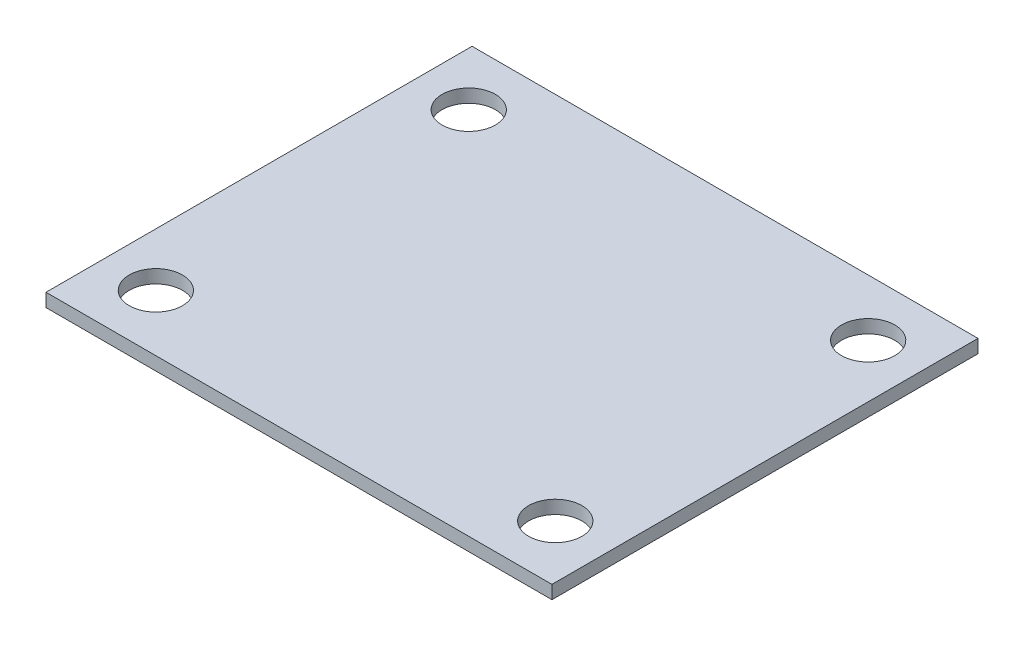
from build123d import *

# Parameters (mm, degrees)
SKETCH1_W               = 38
SKETCH1_H               = 32
BOSS_EXTRUDE1_DEPTH     = 1
SKETCH2_R               = 2
CUT_EXTRUDE1_DEPTH      = 1
MIRROR2_COPY_1_SKETCH_R = 2
MIRROR2_COPY_1_DEPTH    = 1
SKETCH3_R               = 15
SKETCH4_R               = 12
SKETCH5_R               = 9
BOSS_EXTRUDE2_DEPTH     = 1


with BuildPart() as part:
    # Sketch1 → Boss-Extrude1 (new body)
    with BuildSketch(Plane(origin=(0, 0, 0), x_dir=(1, 0, 0), z_dir=(0, 1, 0))):
        Rectangle(SKETCH1_W, SKETCH1_H)
    extrude(amount=BOSS_EXTRUDE1_DEPTH)

    # Sketch2 → Cut-Extrude1 (cut)
    with BuildSketch(Plane(origin=(0, 1, 0), x_dir=(1, 0, 0), z_dir=(0, 1, 0))):
        with Locations(Location((15, -11.75, 0), (0, 0, 270))):
            Circle(SKETCH2_R)
    cut_extrude1 = extrude(amount=-CUT_EXTRUDE1_DEPTH, mode=Mode.SUBTRACT)

    # Mirror1: Cut-Extrude1 across plane
    add(cut_extrude1.mirror(Plane(origin=(0, 0, 0), x_dir=(0, 0, 1), z_dir=(1, 0, 0))), mode=Mode.SUBTRACT)

    # Mirror2: Cut-Extrude1 across plane
    add(cut_extrude1.mirror(Plane.XY), mode=Mode.SUBTRACT)

    # Mirror2 copy 1 sketch → Mirror2 copy 1 (cut)
    with BuildSketch(Plane(origin=(0, 1, 0), x_dir=(-1, 0, 0), z_dir=(0, 1, 0))):
        with Locations(Location((15, -11.75, 0), (0, 0, 270))):
            Circle(MIRROR2_COPY_1_SKETCH_R)
    extrude(amount=-MIRROR2_COPY_1_DEPTH, mode=Mode.SUBTRACT)

    # Sketch3 → Loft1 section 0
    with BuildSketch(Plane.XZ):
        Circle(SKETCH3_R)
    # Sketch4 → Loft1 section 1
    with BuildSketch(Plane.XZ.offset(2)):
        Circle(SKETCH4_R)
    loft()

    # Sketch5 → Boss-Extrude2 (add)
    with BuildSketch(Plane.XZ.offset(2)):
        with Locations(Location((0, 0, 0), (0, 0, 270))):
            Circle(SKETCH5_R)
    extrude(amount=BOSS_EXTRUDE2_DEPTH)


solid = part.part
